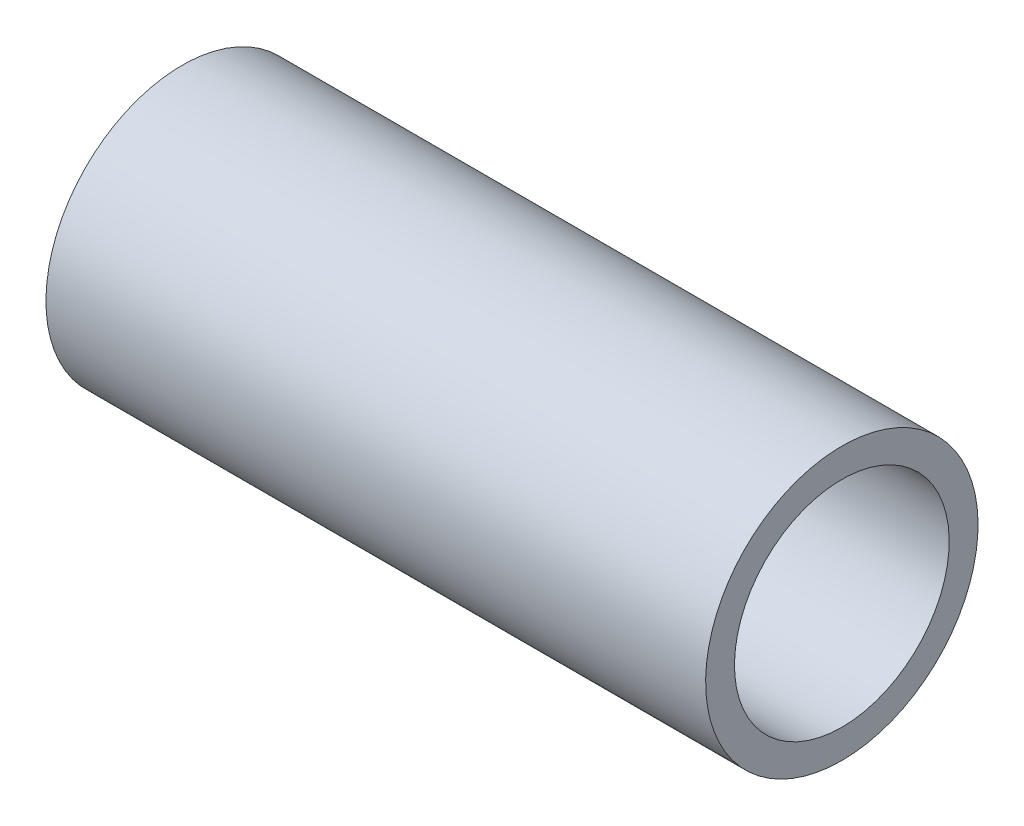
from build123d import *

# Parameters (mm, degrees)
SCHIZZO1_W = 114.3
SCHIZZO1_H = 5


with BuildPart() as part:
    # Schizzo1 → Rivoluzione1 (revolve)
    with BuildSketch(Plane.XY, mode=Mode.PRIVATE) as rivoluzione1_sk:
        with Locations((0, 21.1)):
            Rectangle(SCHIZZO1_W, SCHIZZO1_H)
    revolve(rivoluzione1_sk.sketch.rotate(Axis((-66.661276064, 0, 0), (1, 0, 0)), 180), axis=Axis((-66.661276064, 0, 0), (1, 0, 0)))


solid = part.part
